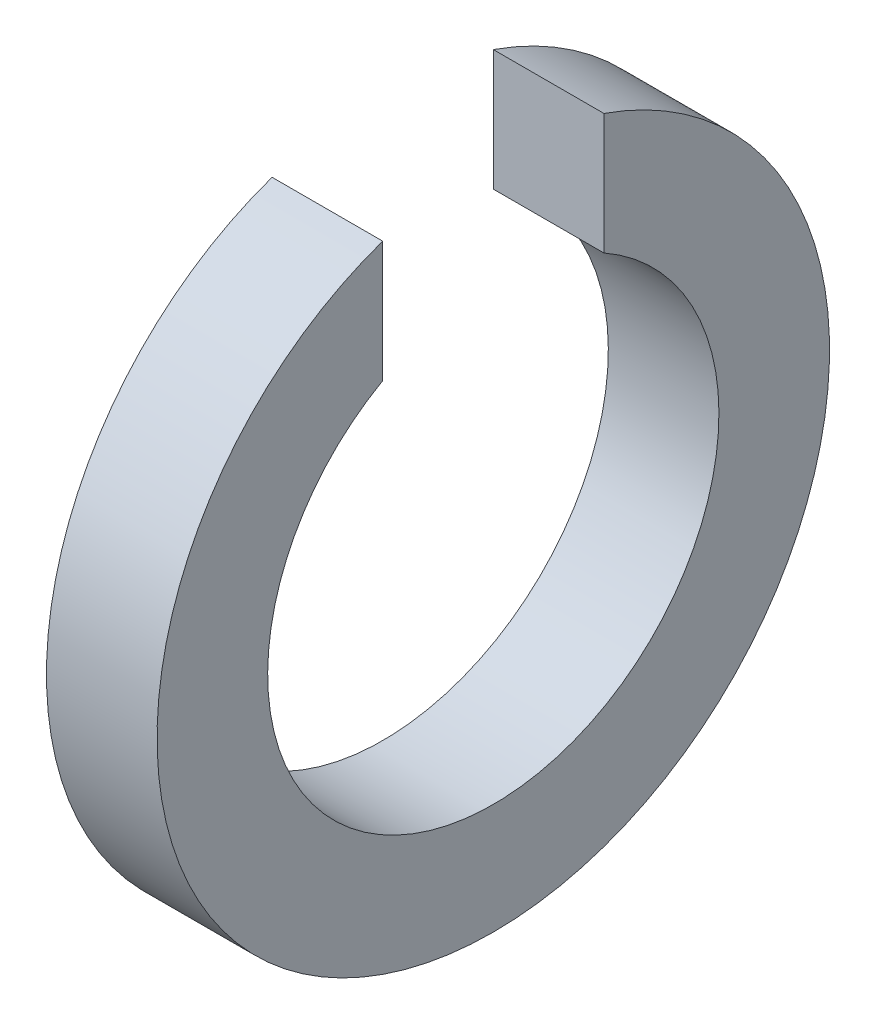
from build123d import *

# Parameters (mm, degrees)
SKETCH1_W          = 2.5
SKETCH1_H          = 2.5
CUT_EXTRUDE1_REACH = 13.035


with BuildPart() as part:
    # Sketch1 → Revolve1 (revolve)
    with BuildSketch(Plane.XY, mode=Mode.PRIVATE) as revolve1_sk:
        with Locations((0, 6.35)):
            Rectangle(SKETCH1_W, SKETCH1_H)
    revolve(revolve1_sk.sketch.rotate(Axis((0, 0, 0), (1, 0, 0)), 90), axis=Axis((0, 0, 0), (1, 0, 0)))

    # Sketch2 → Cut-Extrude1 (cut, up to next)
    with BuildSketch(Plane(origin=(1.25, 0, 0), x_dir=(0, 0, -1), z_dir=(1, 0, 0)), mode=Mode.PRIVATE) as cut_extrude1_sk1:
        with BuildLine():
            Line((-2.5, 7.177046746), (-2.5, 4.445222154))
            ThreePointArc((-2.5, 4.445222154), (0, 5.1), (2.5, 4.445222154))
            Line((2.5, 4.445222154), (2.5, 7.177046746))
            ThreePointArc((2.5, 7.177046746), (0, 7.6), (-2.5, 7.177046746))
        make_face()
    cut_extrude1_tool1 = extrude(cut_extrude1_sk1.sketch, amount=-CUT_EXTRUDE1_REACH, mode=Mode.PRIVATE) & part.part
    add(cut_extrude1_tool1.solids().sort_by_distance((1.25, 6.169958, 0))[0], mode=Mode.SUBTRACT)


solid = part.part
